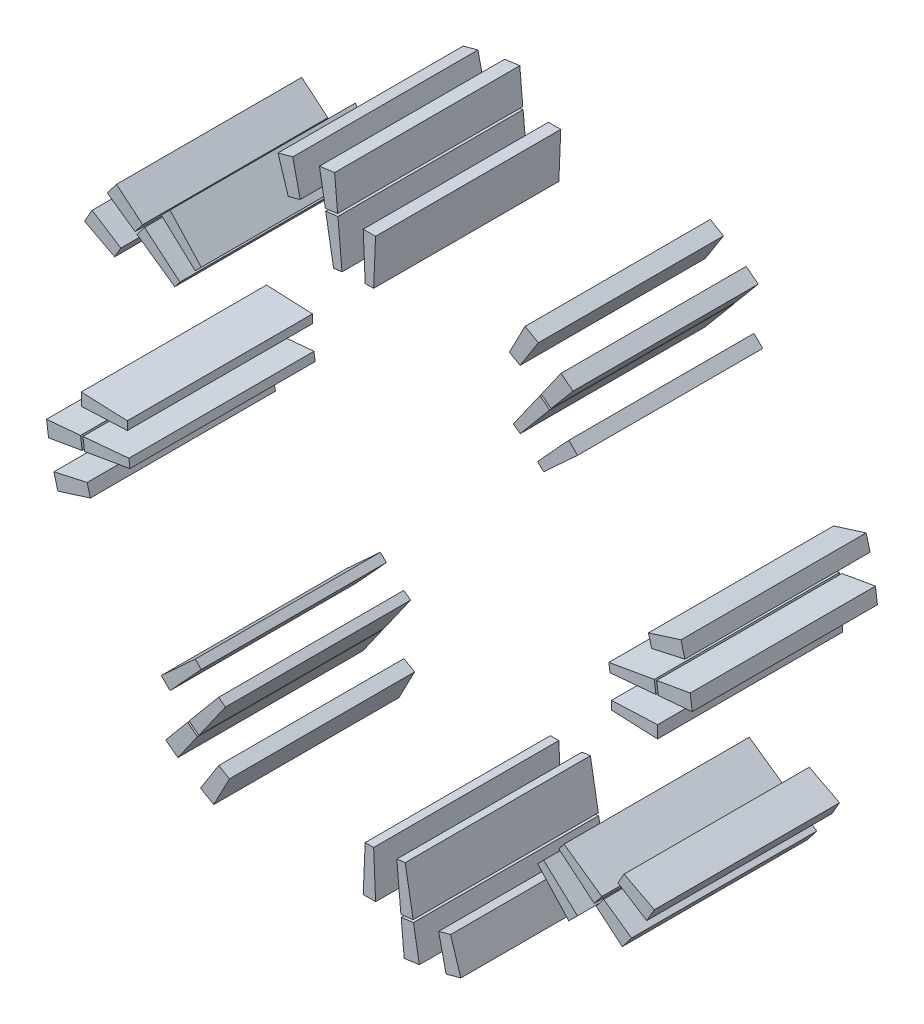
from build123d import *

# Parameters (mm, degrees)
SLOT_COPPER_ENVELOPES_START    = -15
SLOT_COPPER_ENVELOPES_DEPTH    = 30
SLOT_COPPER_ENVELOPES_2_DEPTH  = 30
SLOT_COPPER_ENVELOPES_3_DEPTH  = 30
SLOT_COPPER_ENVELOPES_4_DEPTH  = 30
SLOT_COPPER_ENVELOPES_5_DEPTH  = 30
SLOT_COPPER_ENVELOPES_6_DEPTH  = 30
SLOT_COPPER_ENVELOPES_7_DEPTH  = 30
SLOT_COPPER_ENVELOPES_8_DEPTH  = 30
SLOT_COPPER_ENVELOPES_9_DEPTH  = 30
SLOT_COPPER_ENVELOPES_10_DEPTH = 30
SLOT_COPPER_ENVELOPES_11_DEPTH = 30
SLOT_COPPER_ENVELOPES_12_DEPTH = 30
SLOT_COPPER_ENVELOPES_13_DEPTH = 30
SLOT_COPPER_ENVELOPES_14_DEPTH = 30
SLOT_COPPER_ENVELOPES_15_DEPTH = 30
SLOT_COPPER_ENVELOPES_16_DEPTH = 30
SLOT_COPPER_ENVELOPES_17_DEPTH = 30
SLOT_COPPER_ENVELOPES_18_DEPTH = 30
SLOT_COPPER_ENVELOPES_19_DEPTH = 30
SLOT_COPPER_ENVELOPES_20_DEPTH = 30
SLOT_COPPER_ENVELOPES_21_DEPTH = 30
SLOT_COPPER_ENVELOPES_22_DEPTH = 30
SLOT_COPPER_ENVELOPES_23_DEPTH = 30
SLOT_COPPER_ENVELOPES_24_DEPTH = 30
SLOT_COPPER_ENVELOPES_25_DEPTH = 30
SLOT_COPPER_ENVELOPES_26_DEPTH = 30
SLOT_COPPER_ENVELOPES_27_DEPTH = 30
SLOT_COPPER_ENVELOPES_28_DEPTH = 30
SLOT_COPPER_ENVELOPES_29_DEPTH = 30
SLOT_COPPER_ENVELOPES_30_DEPTH = 30
SLOT_COPPER_ENVELOPES_31_DEPTH = 30
SLOT_COPPER_ENVELOPES_32_DEPTH = 30


with BuildPart() as part:
    # Эскиз1 → Slot_copper_envelopes (new body)
    with BuildSketch(Plane.XY.offset(SLOT_COPPER_ENVELOPES_START)):
        Polygon((39.217051229, -0.6875), (46.676923077, -1.000833333), (46.676923077, 1.000833333), (39.217051229, 0.6875), align=None)
    extrude(amount=SLOT_COPPER_ENVELOPES_DEPTH)


with BuildPart() as body_2:
    # Эскиз1 → Slot_copper_envelopes 2 (new body)
    with BuildSketch(Plane.XY.offset(SLOT_COPPER_ENVELOPES_START)):
        Polygon((46.794259637, 5.151111669), (52.296272873, 5.6367566), (51.973220548, 8.090582631), (46.532989709, 7.1356538), align=None)
    extrude(amount=SLOT_COPPER_ENVELOPES_2_DEPTH)


with BuildPart() as body_3:
    # Эскиз1 → Slot_copper_envelopes 3 (new body)
    with BuildSketch(Plane.XY.offset(SLOT_COPPER_ENVELOPES_START)):
        Polygon((38.971280676, 4.437234025), (46.408230493, 5.100289968), (46.146960565, 7.084832099), (38.791807162, 5.800470709), align=None)
    extrude(amount=SLOT_COPPER_ENVELOPES_3_DEPTH)


with BuildPart() as body_4:
    # Эскиз1 → Slot_copper_envelopes 4 (new body)
    with BuildSketch(Plane.XY.offset(SLOT_COPPER_ENVELOPES_START)):
        Polygon((45.721573267, 11.214919723), (51.113126634, 12.414566731), (50.472549497, 14.805233151), (45.203503812, 13.148381252), align=None)
    extrude(amount=SLOT_COPPER_ENVELOPES_4_DEPTH)


with BuildPart() as body_5:
    # Эскиз1 → Slot_copper_envelopes 5 (new body)
    with BuildSketch(Plane.XY.offset(SLOT_COPPER_ENVELOPES_START)):
        Polygon((28.216778774, 27.24450695), (33.713264869, 32.297872796), (32.297872796, 33.713264869), (27.24450695, 28.216778774), align=None)
    extrude(amount=SLOT_COPPER_ENVELOPES_5_DEPTH)


with BuildPart() as body_6:
    # Эскиз1 → Slot_copper_envelopes 6 (new body)
    with BuildSketch(Plane.XY.offset(SLOT_COPPER_ENVELOPES_START)):
        Polygon((29.446152318, 36.730924302), (32.993260364, 40.964837995), (31.029710847, 42.471522532), (27.858123382, 37.949461762), align=None)
    extrude(amount=SLOT_COPPER_ENVELOPES_6_DEPTH)


with BuildPart() as body_7:
    # Эскиз1 → Slot_copper_envelopes 7 (new body)
    with BuildSketch(Plane.XY.offset(SLOT_COPPER_ENVELOPES_START)):
        Polygon((24.419258569, 30.694455106), (29.209124862, 36.422024107), (27.621095926, 37.640561568), (23.328397726, 31.531502071), align=None)
    extrude(amount=SLOT_COPPER_ENVELOPES_7_DEPTH)


with BuildPart() as body_8:
    # Эскиз1 → Slot_copper_envelopes 8 (new body)
    with BuildSketch(Plane.XY.offset(SLOT_COPPER_ENVELOPES_START)):
        Polygon((24.399888717, 40.26018029), (27.364014129, 44.920862771), (25.220601255, 46.158362771), (22.666394534, 41.261013623), align=None)
    extrude(amount=SLOT_COPPER_ENVELOPES_8_DEPTH)


with BuildPart() as body_9:
    # Эскиз1 → Slot_copper_envelopes 9 (new body)
    with BuildSketch(Plane.XY.offset(SLOT_COPPER_ENVELOPES_START)):
        Polygon((0.6875, 39.217051229), (1.000833333, 46.676923077), (-1.000833333, 46.676923077), (-0.6875, 39.217051229), align=None)
    extrude(amount=SLOT_COPPER_ENVELOPES_9_DEPTH)


with BuildPart() as body_10:
    # Эскиз1 → Slot_copper_envelopes 10 (new body)
    with BuildSketch(Plane.XY.offset(SLOT_COPPER_ENVELOPES_START)):
        Polygon((-5.151111669, 46.794259637), (-5.6367566, 52.296272873), (-8.090582631, 51.973220548), (-7.1356538, 46.532989709), align=None)
    extrude(amount=SLOT_COPPER_ENVELOPES_10_DEPTH)


with BuildPart() as body_11:
    # Эскиз1 → Slot_copper_envelopes 11 (new body)
    with BuildSketch(Plane.XY.offset(SLOT_COPPER_ENVELOPES_START)):
        Polygon((-4.437234025, 38.971280676), (-5.100289968, 46.408230493), (-7.084832099, 46.146960565), (-5.800470709, 38.791807162), align=None)
    extrude(amount=SLOT_COPPER_ENVELOPES_11_DEPTH)


with BuildPart() as body_12:
    # Эскиз1 → Slot_copper_envelopes 12 (new body)
    with BuildSketch(Plane.XY.offset(SLOT_COPPER_ENVELOPES_START)):
        Polygon((-11.214919723, 45.721573267), (-12.414566731, 51.113126634), (-14.805233151, 50.472549497), (-13.148381252, 45.203503812), align=None)
    extrude(amount=SLOT_COPPER_ENVELOPES_12_DEPTH)


with BuildPart() as body_13:
    # Эскиз1 → Slot_copper_envelopes 13 (new body)
    with BuildSketch(Plane.XY.offset(SLOT_COPPER_ENVELOPES_START)):
        Polygon((-27.24450695, 28.216778774), (-32.297872796, 33.713264869), (-33.713264869, 32.297872796), (-28.216778774, 27.24450695), align=None)
    extrude(amount=SLOT_COPPER_ENVELOPES_13_DEPTH)


with BuildPart() as body_14:
    # Эскиз1 → Slot_copper_envelopes 14 (new body)
    with BuildSketch(Plane.XY.offset(SLOT_COPPER_ENVELOPES_START)):
        Polygon((-36.730924302, 29.446152318), (-40.964837995, 32.993260364), (-42.471522532, 31.029710847), (-37.949461762, 27.858123382), align=None)
    extrude(amount=SLOT_COPPER_ENVELOPES_14_DEPTH)


with BuildPart() as body_15:
    # Эскиз1 → Slot_copper_envelopes 15 (new body)
    with BuildSketch(Plane.XY.offset(SLOT_COPPER_ENVELOPES_START)):
        Polygon((-30.694455106, 24.419258569), (-36.422024107, 29.209124862), (-37.640561568, 27.621095926), (-31.531502071, 23.328397726), align=None)
    extrude(amount=SLOT_COPPER_ENVELOPES_15_DEPTH)


with BuildPart() as body_16:
    # Эскиз1 → Slot_copper_envelopes 16 (new body)
    with BuildSketch(Plane.XY.offset(SLOT_COPPER_ENVELOPES_START)):
        Polygon((-40.26018029, 24.399888717), (-44.920862771, 27.364014129), (-46.158362771, 25.220601255), (-41.261013623, 22.666394534), align=None)
    extrude(amount=SLOT_COPPER_ENVELOPES_16_DEPTH)


with BuildPart() as body_17:
    # Эскиз1 → Slot_copper_envelopes 17 (new body)
    with BuildSketch(Plane.XY.offset(SLOT_COPPER_ENVELOPES_START)):
        Polygon((-39.217051229, 0.6875), (-46.676923077, 1.000833333), (-46.676923077, -1.000833333), (-39.217051229, -0.6875), align=None)
    extrude(amount=SLOT_COPPER_ENVELOPES_17_DEPTH)


with BuildPart() as body_18:
    # Эскиз1 → Slot_copper_envelopes 18 (new body)
    with BuildSketch(Plane.XY.offset(SLOT_COPPER_ENVELOPES_START)):
        Polygon((-46.794259637, -5.151111669), (-52.296272873, -5.6367566), (-51.973220548, -8.090582631), (-46.532989709, -7.1356538), align=None)
    extrude(amount=SLOT_COPPER_ENVELOPES_18_DEPTH)


with BuildPart() as body_19:
    # Эскиз1 → Slot_copper_envelopes 19 (new body)
    with BuildSketch(Plane.XY.offset(SLOT_COPPER_ENVELOPES_START)):
        Polygon((-38.971280676, -4.437234025), (-46.408230493, -5.100289968), (-46.146960565, -7.084832099), (-38.791807162, -5.800470709), align=None)
    extrude(amount=SLOT_COPPER_ENVELOPES_19_DEPTH)


with BuildPart() as body_20:
    # Эскиз1 → Slot_copper_envelopes 20 (new body)
    with BuildSketch(Plane.XY.offset(SLOT_COPPER_ENVELOPES_START)):
        Polygon((-45.721573267, -11.214919723), (-51.113126634, -12.414566731), (-50.472549497, -14.805233151), (-45.203503812, -13.148381252), align=None)
    extrude(amount=SLOT_COPPER_ENVELOPES_20_DEPTH)


with BuildPart() as body_21:
    # Эскиз1 → Slot_copper_envelopes 21 (new body)
    with BuildSketch(Plane.XY.offset(SLOT_COPPER_ENVELOPES_START)):
        Polygon((-28.216778774, -27.24450695), (-33.713264869, -32.297872796), (-32.297872796, -33.713264869), (-27.24450695, -28.216778774), align=None)
    extrude(amount=SLOT_COPPER_ENVELOPES_21_DEPTH)


with BuildPart() as body_22:
    # Эскиз1 → Slot_copper_envelopes 22 (new body)
    with BuildSketch(Plane.XY.offset(SLOT_COPPER_ENVELOPES_START)):
        Polygon((-29.446152318, -36.730924302), (-32.993260364, -40.964837995), (-31.029710847, -42.471522532), (-27.858123382, -37.949461762), align=None)
    extrude(amount=SLOT_COPPER_ENVELOPES_22_DEPTH)


with BuildPart() as body_23:
    # Эскиз1 → Slot_copper_envelopes 23 (new body)
    with BuildSketch(Plane.XY.offset(SLOT_COPPER_ENVELOPES_START)):
        Polygon((-24.419258569, -30.694455106), (-29.209124862, -36.422024107), (-27.621095926, -37.640561568), (-23.328397726, -31.531502071), align=None)
    extrude(amount=SLOT_COPPER_ENVELOPES_23_DEPTH)


with BuildPart() as body_24:
    # Эскиз1 → Slot_copper_envelopes 24 (new body)
    with BuildSketch(Plane.XY.offset(SLOT_COPPER_ENVELOPES_START)):
        Polygon((-24.399888717, -40.26018029), (-27.364014129, -44.920862771), (-25.220601255, -46.158362771), (-22.666394534, -41.261013623), align=None)
    extrude(amount=SLOT_COPPER_ENVELOPES_24_DEPTH)


with BuildPart() as body_25:
    # Эскиз1 → Slot_copper_envelopes 25 (new body)
    with BuildSketch(Plane.XY.offset(SLOT_COPPER_ENVELOPES_START)):
        Polygon((-0.6875, -39.217051229), (-1.000833333, -46.676923077), (1.000833333, -46.676923077), (0.6875, -39.217051229), align=None)
    extrude(amount=SLOT_COPPER_ENVELOPES_25_DEPTH)


with BuildPart() as body_26:
    # Эскиз1 → Slot_copper_envelopes 26 (new body)
    with BuildSketch(Plane.XY.offset(SLOT_COPPER_ENVELOPES_START)):
        Polygon((5.151111669, -46.794259637), (5.6367566, -52.296272873), (8.090582631, -51.973220548), (7.1356538, -46.532989709), align=None)
    extrude(amount=SLOT_COPPER_ENVELOPES_26_DEPTH)


with BuildPart() as body_27:
    # Эскиз1 → Slot_copper_envelopes 27 (new body)
    with BuildSketch(Plane.XY.offset(SLOT_COPPER_ENVELOPES_START)):
        Polygon((4.437234025, -38.971280676), (5.100289968, -46.408230493), (7.084832099, -46.146960565), (5.800470709, -38.791807162), align=None)
    extrude(amount=SLOT_COPPER_ENVELOPES_27_DEPTH)


with BuildPart() as body_28:
    # Эскиз1 → Slot_copper_envelopes 28 (new body)
    with BuildSketch(Plane.XY.offset(SLOT_COPPER_ENVELOPES_START)):
        Polygon((11.214919723, -45.721573267), (12.414566731, -51.113126634), (14.805233151, -50.472549497), (13.148381252, -45.203503812), align=None)
    extrude(amount=SLOT_COPPER_ENVELOPES_28_DEPTH)


with BuildPart() as body_29:
    # Эскиз1 → Slot_copper_envelopes 29 (new body)
    with BuildSketch(Plane.XY.offset(SLOT_COPPER_ENVELOPES_START)):
        Polygon((27.24450695, -28.216778774), (32.297872796, -33.713264869), (33.713264869, -32.297872796), (28.216778774, -27.24450695), align=None)
    extrude(amount=SLOT_COPPER_ENVELOPES_29_DEPTH)


with BuildPart() as body_30:
    # Эскиз1 → Slot_copper_envelopes 30 (new body)
    with BuildSketch(Plane.XY.offset(SLOT_COPPER_ENVELOPES_START)):
        Polygon((36.730924302, -29.446152318), (40.964837995, -32.993260364), (42.471522532, -31.029710847), (37.949461762, -27.858123382), align=None)
    extrude(amount=SLOT_COPPER_ENVELOPES_30_DEPTH)


with BuildPart() as body_31:
    # Эскиз1 → Slot_copper_envelopes 31 (new body)
    with BuildSketch(Plane.XY.offset(SLOT_COPPER_ENVELOPES_START)):
        Polygon((30.694455106, -24.419258569), (36.422024107, -29.209124862), (37.640561568, -27.621095926), (31.531502071, -23.328397726), align=None)
    extrude(amount=SLOT_COPPER_ENVELOPES_31_DEPTH)


with BuildPart() as body_32:
    # Эскиз1 → Slot_copper_envelopes 32 (new body)
    with BuildSketch(Plane.XY.offset(SLOT_COPPER_ENVELOPES_START)):
        Polygon((40.26018029, -24.399888717), (44.920862771, -27.364014129), (46.158362771, -25.220601255), (41.261013623, -22.666394534), align=None)
    extrude(amount=SLOT_COPPER_ENVELOPES_32_DEPTH)


solid = Compound([part.part, body_2.part, body_3.part, body_4.part, body_5.part, body_6.part, body_7.part, body_8.part, body_9.part, body_10.part, body_11.part, body_12.part, body_13.part, body_14.part, body_15.part, body_16.part, body_17.part, body_18.part, body_19.part, body_20.part, body_21.part, body_22.part, body_23.part, body_24.part, body_25.part, body_26.part, body_27.part, body_28.part, body_29.part, body_30.part, body_31.part, body_32.part])
